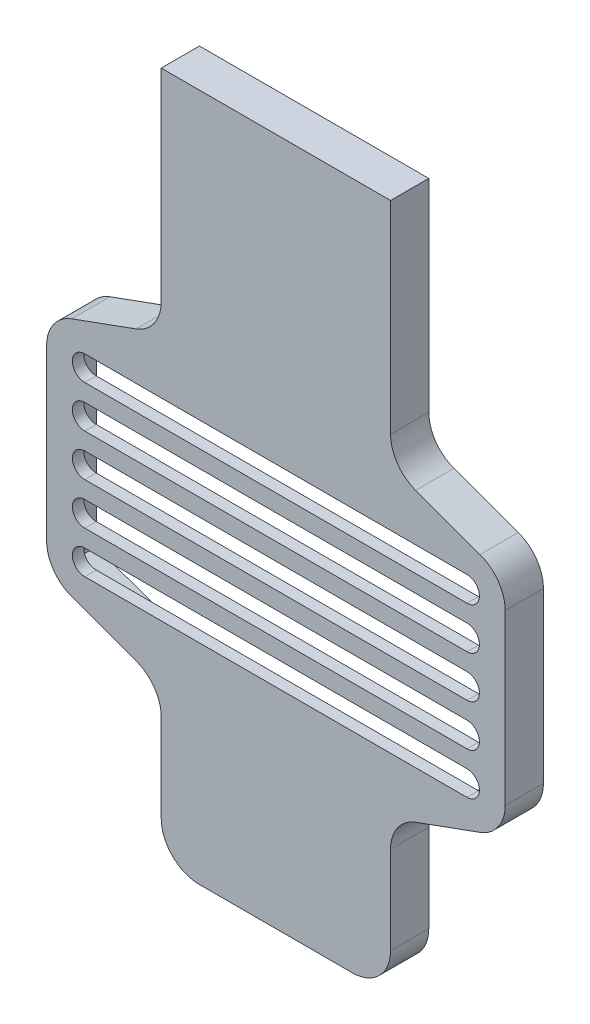
from build123d import *

# Parameters (mm, degrees)
EXTRUDE_1_DEPTH     = 10
FILLET_1_R          = 10
CUT_EXTRUDE_1_DEPTH = 211.475651798
CUT_EXTRUDE_2_DEPTH = 7
SKETCH_4_W          = 20.2
SKETCH_4_H          = 40
CUT_EXTRUDE_3_DEPTH = 7
CUT_EXTRUDE_4_DEPTH = 7


with BuildPart() as part:
    # Эскиз1 → Бобышка-Вытянуть1 (new body)
    with BuildSketch(Plane.XY):
        Polygon((0, 0), (60, 0), (60, -60), (90, -70.919107028), (90, -129.080892972), (60, -140), (60, -180), (0, -180), (0, -140), (-30, -129.080892972), (-30, -70.919107028), (0, -60), align=None)
    extrude(amount=EXTRUDE_1_DEPTH)

    # Скругление1
    fillet_1_edges = [part.edges().sort_by_distance(p)[0] for p in [
        (60, -60, 5),
        (90, -70.919107028, 5),
        (90, -129.080892972, 5),
        (60, -140, 5),
        (60, -180, 5),
        (0, -180, 5),
        (0, -140, 5),
        (-30, -129.080892972, 5),
        (-30, -70.919107028, 5),
        (0, -60, 5),
    ]]
    fillet(fillet_1_edges, radius=FILLET_1_R)

    # Эскиз2 → Вырез-Вытянуть1 (cut, through all)
    with BuildSketch(Plane(origin=(0, 10, 10), x_dir=(-1, 0, 0), z_dir=(0, 0, 1))):
        with BuildLine():
            Line((20, 102.25), (-80, 102.25))
            ThreePointArc((-80, 102.25), (-83.25, 99), (-80, 95.75))
            Line((-80, 95.75), (20, 95.75))
            ThreePointArc((20, 95.75), (23.25, 99), (20, 102.25))
        make_face()
        with BuildLine():
            Line((20, 91.25), (-80, 91.25))
            ThreePointArc((-80, 91.25), (-83.25, 88), (-80, 84.75))
            Line((-80, 84.75), (20, 84.75))
            ThreePointArc((20, 84.75), (23.25, 88), (20, 91.25))
        make_face()
        with BuildLine():
            Line((20, 113.25), (-80, 113.25))
            ThreePointArc((-80, 113.25), (-83.25, 110), (-80, 106.75))
            Line((-80, 106.75), (20, 106.75))
            ThreePointArc((20, 106.75), (23.25, 110), (20, 113.25))
        make_face()
        with BuildLine():
            Line((20, 124.25), (-80, 124.25))
            ThreePointArc((-80, 124.25), (-83.25, 121), (-80, 117.75))
            Line((-80, 117.75), (20, 117.75))
            ThreePointArc((20, 117.75), (23.25, 121), (20, 124.25))
        make_face()
        with BuildLine():
            Line((20, 135.25), (-80, 135.25))
            ThreePointArc((-80, 135.25), (-83.25, 132), (-80, 128.75))
            Line((-80, 128.75), (20, 128.75))
            ThreePointArc((20, 128.75), (23.25, 132), (20, 135.25))
        make_face()
    extrude(amount=-CUT_EXTRUDE_1_DEPTH, mode=Mode.SUBTRACT)

    # Эскиз3 → Вырез-Вытянуть2 (cut)
    with BuildSketch(Plane(origin=(0, 0, 0), x_dir=(-1, 0, 0), z_dir=(0, 0, -1))):
        Polygon((-57, -137.899377385), (-3, -137.899377385), (27, -126.980270357), (27, -73.019729643), (-3, -62.100622615), (-57, -62.100622615), (-87, -73.019729643), (-87, -126.980270357), align=None)
    extrude(amount=-CUT_EXTRUDE_2_DEPTH, mode=Mode.SUBTRACT)

    # Эскиз4 → Вырез-Вытянуть3 (cut)
    with BuildSketch(Plane(origin=(0, 0, 0), x_dir=(-1, 0, 0), z_dir=(0, 0, -1))):
        with Locations((-30, -44.75)):
            Rectangle(SKETCH_4_W, SKETCH_4_H)
    extrude(amount=-CUT_EXTRUDE_3_DEPTH, mode=Mode.SUBTRACT)

    # Эскиз6 → Вырез-Вытянуть4 (cut)
    with BuildSketch(Plane(origin=(0, 0, 0), x_dir=(-1, 0, 0), z_dir=(0, 0, -1))):
        with BuildLine():
            Line((-57, -135), (-57, -170))
            ThreePointArc((-57, -170), (-53.85, -173.15), (-50.7, -170))
            Line((-50.7, -170), (-50.7, -135))
            ThreePointArc((-50.7, -135), (-53.85, -131.85), (-57, -135))
        make_face()
        with BuildLine():
            Line((-47.46, -135), (-47.46, -170))
            ThreePointArc((-47.46, -170), (-44.31, -173.15), (-41.16, -170))
            Line((-41.16, -170), (-41.16, -135))
            ThreePointArc((-41.16, -135), (-44.31, -131.85), (-47.46, -135))
        make_face()
        with BuildLine():
            Line((-37.92, -135), (-37.92, -170))
            ThreePointArc((-37.92, -170), (-34.77, -173.15), (-31.62, -170))
            Line((-31.62, -170), (-31.62, -135))
            ThreePointArc((-31.62, -135), (-34.77, -131.85), (-37.92, -135))
        make_face()
        with BuildLine():
            Line((-28.38, -135), (-28.38, -170))
            ThreePointArc((-28.38, -170), (-25.23, -173.15), (-22.08, -170))
            Line((-22.08, -170), (-22.08, -135))
            ThreePointArc((-22.08, -135), (-25.23, -131.85), (-28.38, -135))
        make_face()
        with BuildLine():
            Line((-18.84, -135), (-18.84, -170))
            ThreePointArc((-18.84, -170), (-15.69, -173.15), (-12.54, -170))
            Line((-12.54, -170), (-12.54, -135))
            ThreePointArc((-12.54, -135), (-15.69, -131.85), (-18.84, -135))
        make_face()
        with BuildLine():
            Line((-9.3, -135), (-9.3, -170))
            ThreePointArc((-9.3, -170), (-6.15, -173.15), (-3, -170))
            Line((-3, -170), (-3, -135))
            ThreePointArc((-3, -135), (-6.15, -131.85), (-9.3, -135))
        make_face()
    extrude(amount=-CUT_EXTRUDE_4_DEPTH, mode=Mode.SUBTRACT)


solid = part.part
